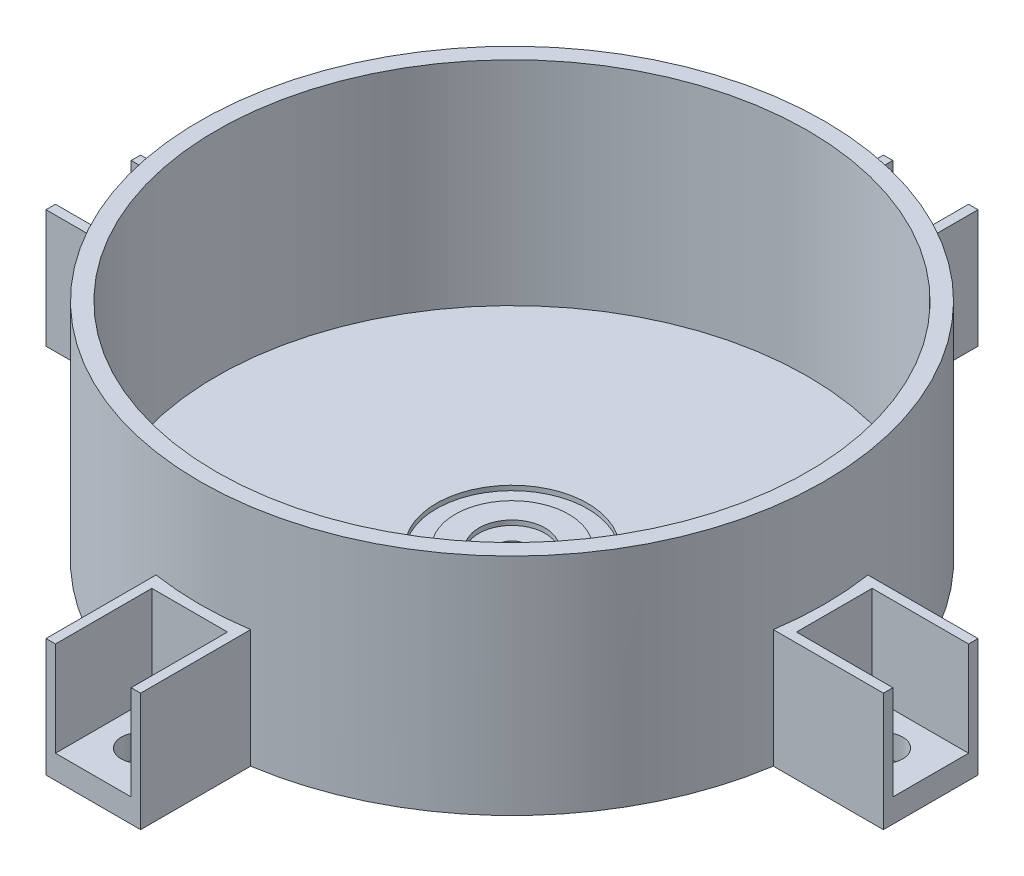
from build123d import *

# Parameters (mm, degrees)
SKETCH1_R           = 132
BOSS_EXTRUDE1_DEPTH = 5
SKETCH2_R           = 132
SKETCH2_R_2         = 125
BOSS_EXTRUDE2_DEPTH = 90
SKETCH3_W           = 49.925821921
SKETCH3_H           = 40
BOSS_EXTRUDE4_DEPTH = 50
SKETCH4_W           = 40.744064535
SKETCH4_H           = 32
CUT_EXTRUDE1_DEPTH  = 40
SKETCH5_R           = 8
CUT_EXTRUDE2_DEPTH  = 40
CIRPATTERN2_COUNT   = 4
SKETCH7_R           = 32
SKETCH7_R_2         = 28
CUT_EXTRUDE3_DEPTH  = 2
SKETCH8_R           = 6
CUT_EXTRUDE4_DEPTH  = 3
BOSS_EXTRUDE5_START = -5
SKETCH9_R           = 32
BOSS_EXTRUDE5_DEPTH = 5
SKETCH10_R          = 32
SKETCH10_R_2        = 24
CUT_EXTRUDE5_DEPTH  = 2
SKETCH11_R          = 14
SKETCH11_R_2        = 6
CUT_EXTRUDE6_DEPTH  = 2
SKETCH12_R          = 6
CUT_EXTRUDE7_DEPTH  = 3


with BuildPart() as part:
    # Sketch1 → Boss-Extrude1 (new body)
    with BuildSketch(Plane(origin=(0, 0, 0), x_dir=(1, 0, 0), z_dir=(0, 1, 0))):
        with Locations(Location((0, 0, 0), (0, 0, 270))):
            Circle(SKETCH1_R)
    extrude(amount=BOSS_EXTRUDE1_DEPTH)

    # Sketch2 → Boss-Extrude2 (add)
    with BuildSketch(Plane(origin=(0, 5, 0), x_dir=(1, 0, 0), z_dir=(0, 1, 0))):
        with Locations(Location((0, 0, 0), (0, 0, 270))):
            Circle(SKETCH2_R)
        with Locations(Location((0, 0, 0), (0, 0, 270))):
            Circle(SKETCH2_R_2, mode=Mode.SUBTRACT)
    extrude(amount=BOSS_EXTRUDE2_DEPTH)

    # Sketch3 → Boss-Extrude4 (add)
    with BuildSketch(Plane.XZ):
        with Locations((-152.03708904, 0)):
            Rectangle(SKETCH3_W, SKETCH3_H)
    extrude(amount=-BOSS_EXTRUDE4_DEPTH)

    # Sketch4 → Cut-Extrude1 (cut)
    with BuildSketch(Plane(origin=(0, 50, 0), x_dir=(1, 0, 0), z_dir=(0, 1, 0))):
        with Locations((-156.627967732, 0)):
            Rectangle(SKETCH4_W, SKETCH4_H)
    extrude(amount=-CUT_EXTRUDE1_DEPTH, mode=Mode.SUBTRACT)

    # Sketch5 → Cut-Extrude2 (cut)
    with BuildSketch(Plane(origin=(0, 10, 0), x_dir=(1, 0, 0), z_dir=(0, 1, 0))):
        with Locations(Location((-157.186334462, 0, 0), (0, 0, 270))):
            Circle(SKETCH5_R)
    extrude(amount=-CUT_EXTRUDE2_DEPTH, mode=Mode.SUBTRACT)


with BuildPart() as cirpattern2_1:
    # CirPattern2: pattern copy
    add(part.part.rotate(Axis((0, 0, 0), (0, 1, 0)), 1 * 360 / CIRPATTERN2_COUNT))


with BuildPart() as cirpattern2_2:
    # CirPattern2: pattern copy
    add(part.part.rotate(Axis((0, 0, 0), (0, 1, 0)), 2 * 360 / CIRPATTERN2_COUNT))


with BuildPart() as cirpattern2_3:
    # CirPattern2: pattern copy
    add(part.part.rotate(Axis((0, 0, 0), (0, 1, 0)), 3 * 360 / CIRPATTERN2_COUNT))


with BuildPart() as cut_extrude3_tool:
    # Sketch7 → Cut-Extrude3 (new body)
    with BuildSketch(Plane(origin=(0, 5, 0), x_dir=(1, 0, 0), z_dir=(0, 1, 0))):
        with Locations(Location((0, 0, 0), (0, 0, 270))):
            Circle(SKETCH7_R)
        with Locations(Location((0, 0, 0), (0, 0, 270))):
            Circle(SKETCH7_R_2, mode=Mode.SUBTRACT)
    extrude(amount=-CUT_EXTRUDE3_DEPTH)


with BuildPart() as part_1:
    add(part.part)

    # Cut-Extrude3: cut by cut_extrude3_tool
    add(cut_extrude3_tool.part, mode=Mode.SUBTRACT)


with BuildPart() as cirpattern2_1_1:
    add(cirpattern2_1.part)

    # Cut-Extrude3: cut by cut_extrude3_tool
    add(cut_extrude3_tool.part, mode=Mode.SUBTRACT)


with BuildPart() as cirpattern2_2_1:
    add(cirpattern2_2.part)

    # Cut-Extrude3: cut by cut_extrude3_tool
    add(cut_extrude3_tool.part, mode=Mode.SUBTRACT)


with BuildPart() as cirpattern2_3_1:
    add(cirpattern2_3.part)

    # Cut-Extrude3: cut by cut_extrude3_tool
    add(cut_extrude3_tool.part, mode=Mode.SUBTRACT)


with BuildPart() as cut_extrude4_tool:
    # Sketch8 → Cut-Extrude4 (new body)
    with BuildSketch(Plane(origin=(0, 5, 0), x_dir=(1, 0, 0), z_dir=(0, 1, 0))):
        with Locations(Location((0, 0, 0), (0, 0, 270))):
            Circle(SKETCH8_R)
    extrude(amount=-CUT_EXTRUDE4_DEPTH)


with BuildPart() as part_2:
    add(part_1.part)

    # Cut-Extrude4: cut by cut_extrude4_tool
    add(cut_extrude4_tool.part, mode=Mode.SUBTRACT)



with BuildPart() as cirpattern2_1_2:
    add(cirpattern2_1_1.part)

    # Cut-Extrude4: cut by cut_extrude4_tool
    add(cut_extrude4_tool.part, mode=Mode.SUBTRACT)


with BuildPart() as cirpattern2_2_2:
    add(cirpattern2_2_1.part)

    # Cut-Extrude4: cut by cut_extrude4_tool
    add(cut_extrude4_tool.part, mode=Mode.SUBTRACT)


with BuildPart() as cirpattern2_3_2:
    add(cirpattern2_3_1.part)

    # Cut-Extrude4: cut by cut_extrude4_tool
    add(cut_extrude4_tool.part, mode=Mode.SUBTRACT)


with BuildPart() as part_3:
    add(part_2.part)

    add(cirpattern2_1_2.part)  # Boss-Extrude5 merges CirPattern2_1

    add(cirpattern2_2_2.part)  # Boss-Extrude5 merges CirPattern2_2

    add(cirpattern2_3_2.part)  # Boss-Extrude5 merges CirPattern2_3
    # Sketch9 → Boss-Extrude5 (add)
    with BuildSketch(Plane.XZ.offset(BOSS_EXTRUDE5_START)):
        Circle(SKETCH9_R)
    extrude(amount=BOSS_EXTRUDE5_DEPTH)

    # Sketch10 → Cut-Extrude5 (cut)
    with BuildSketch(Plane(origin=(0, 5, 0), x_dir=(1, 0, 0), z_dir=(0, 1, 0))):
        with Locations(Location((0, 0, 0), (0, 0, 270))):
            Circle(SKETCH10_R)
        with Locations(Location((0, 0, 0), (0, 0, 270))):
            Circle(SKETCH10_R_2, mode=Mode.SUBTRACT)
    extrude(amount=-CUT_EXTRUDE5_DEPTH, mode=Mode.SUBTRACT)

    # Sketch11 → Cut-Extrude6 (cut)
    with BuildSketch(Plane(origin=(0, 5, 0), x_dir=(1, 0, 0), z_dir=(0, 1, 0))):
        with Locations(Location((0, 0, 0), (0, 0, 270))):
            Circle(SKETCH11_R)
        with Locations(Location((0, 0, 0), (0, 0, 270))):
            Circle(SKETCH11_R_2, mode=Mode.SUBTRACT)
    extrude(amount=-CUT_EXTRUDE6_DEPTH, mode=Mode.SUBTRACT)

    # Sketch12 → Cut-Extrude7 (cut)
    with BuildSketch(Plane(origin=(0, 5, 0), x_dir=(1, 0, 0), z_dir=(0, 1, 0))):
        with Locations(Location((0, 0, 0), (0, 0, 270))):
            Circle(SKETCH12_R)
    extrude(amount=-CUT_EXTRUDE7_DEPTH, mode=Mode.SUBTRACT)


solid = part_3.part
